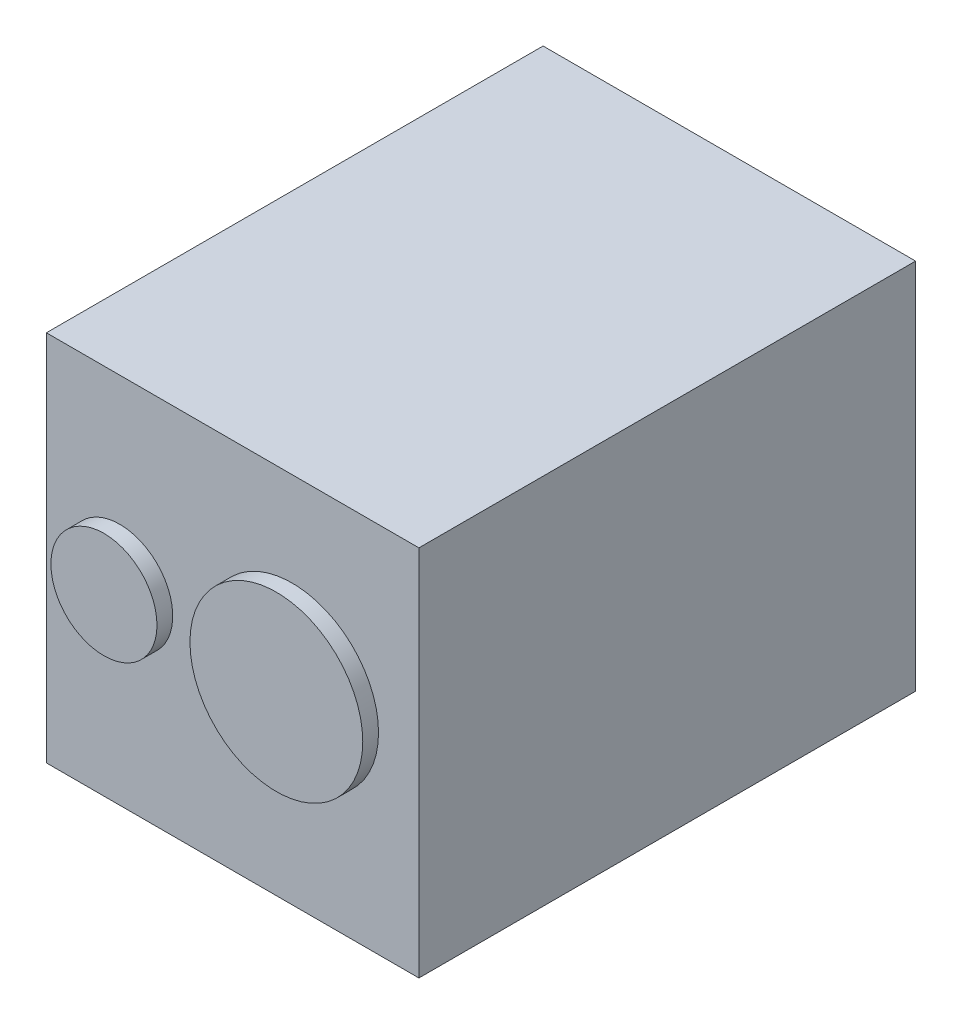
from build123d import *

# Parameters (mm, degrees)
SKETCH1_W           = 300
SKETCH1_H           = 300
BOSS_EXTRUDE1_DEPTH = 400
SKETCH2_R           = 42.704595991
SKETCH2_R_2         = 69.587993354
BOSS_EXTRUDE2_DEPTH = 12.7


with BuildPart() as part:
    # Sketch1 → Boss-Extrude1 (new body)
    with BuildSketch(Plane.XY):
        with Locations((150, 150)):
            Rectangle(SKETCH1_W, SKETCH1_H)
    extrude(amount=BOSS_EXTRUDE1_DEPTH)

    # Sketch2 → Boss-Extrude2 (add)
    with BuildSketch(Plane.XY.offset(400)):
        with Locations(Location((59.050998503, 153.288809659, 0), (0, 0, 180))):
            Circle(SKETCH2_R)
        with Locations(Location((197.894381645, 154.860769066, 0), (0, 0, 180))):
            Circle(SKETCH2_R_2)
    extrude(amount=BOSS_EXTRUDE2_DEPTH)


solid = part.part
